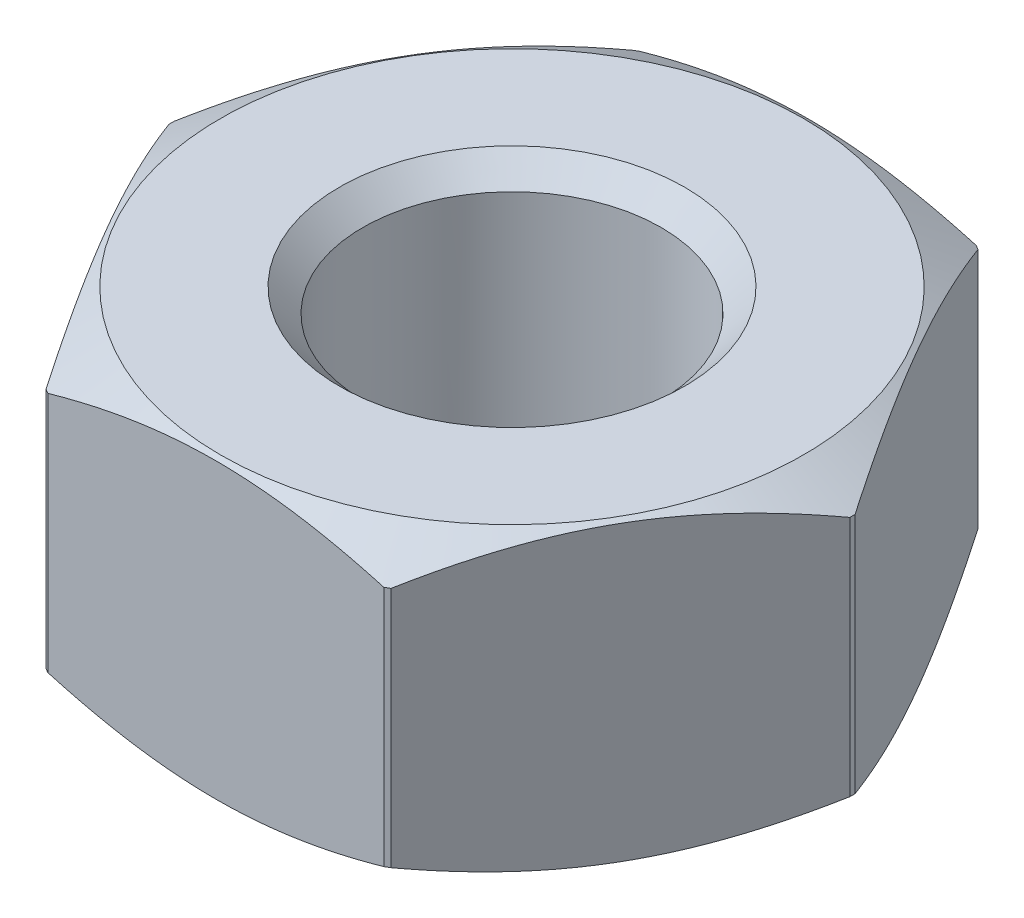
from build123d import *

# Parameters (mm, degrees)
SKETCH2_OUTSIDE_W  = 20.924
SKETCH2_OUTSIDE_H  = 20.924
CUT_EXTRUDE1_DEPTH = 6.4
CHAMFER1_SIZE      = 0.5


with BuildPart() as part:
    # Sketch1 → Revolve1 (revolve)
    with BuildSketch(Plane(origin=(0, 0, 0), x_dir=(0, 0, -1), z_dir=(1, 0, 0)), mode=Mode.PRIVATE) as revolve1_sk:
        Polygon((3.2, 3.2), (3.2, -3.2), (6.25, -3.2), (7.3, -2.593782217), (7.3, 2.593782217), (6.25, 3.2), align=None)
    revolve(revolve1_sk.sketch.rotate(Axis((0, 12.02962963, 0), (0, -1, 0)), 180), axis=Axis((0, 12.02962963, 0), (0, -1, 0)))

    # Sketch2 outside → Cut-Extrude1 (cut)
    with BuildSketch(Plane(origin=(0, 3.2, 0), x_dir=(1, 0, 0), z_dir=(0, 1, 0))):
        Rectangle(SKETCH2_OUTSIDE_W, SKETCH2_OUTSIDE_H)
        Polygon((7.332348419, 0), (3.666174209, 6.35), (-3.666174209, 6.35), (-7.332348419, 0), (-3.666174209, -6.35), (3.666174209, -6.35), align=None, mode=Mode.SUBTRACT)
    extrude(amount=-CUT_EXTRUDE1_DEPTH, mode=Mode.SUBTRACT)

    # Chamfer1
    chamfer1_edges = [part.edges().sort_by_distance(p)[0] for p in [
        (0, -3.2, -3.2),
        (0, 3.2, -3.2),
    ]]
    chamfer(chamfer1_edges, length=CHAMFER1_SIZE)


solid = part.part
